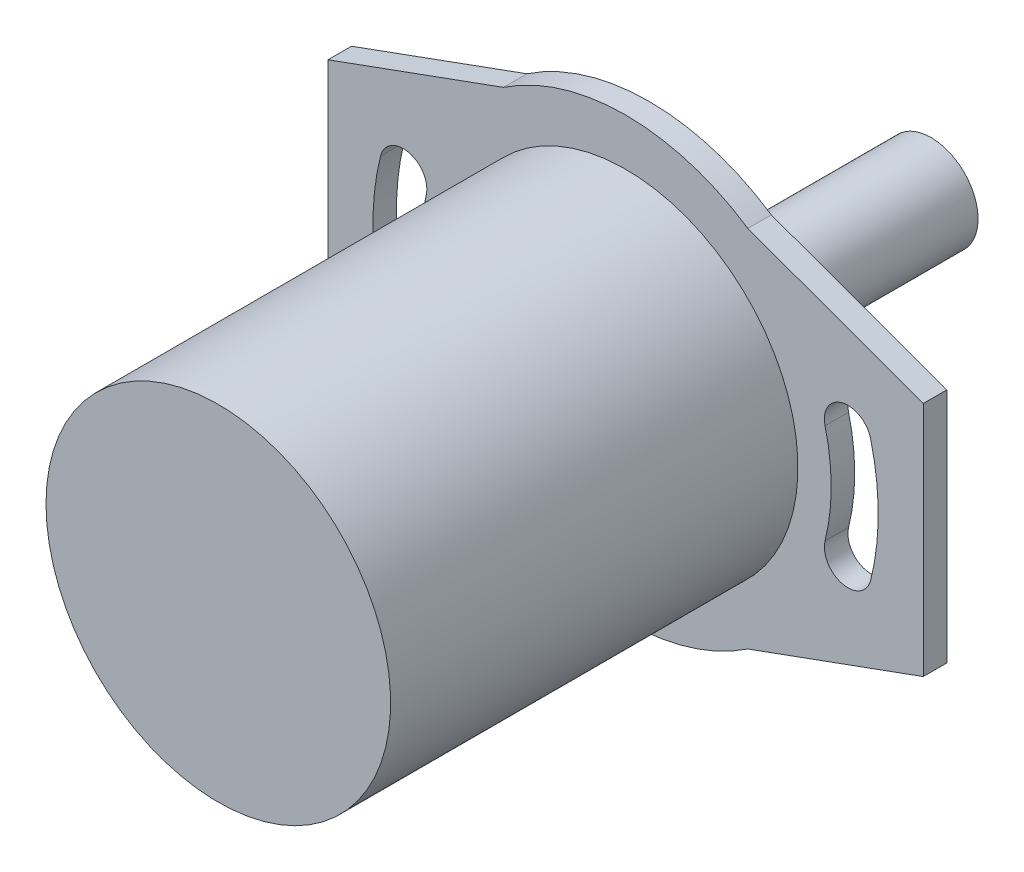
from build123d import *

# Parameters (mm, degrees)
ESQUISSE1_R             = 11
BOSS_EXTRU_1_DEPTH      = 26
BOSS_EXTRU_2_DEPTH      = 1.5
ENL_V_MAT_EXTRU_1_DEPTH = 1.5
ESQUISSE4_R             = 3
BOSS_EXTRU_3_DEPTH      = 18


with BuildPart() as part:
    # Esquisse1 → Boss.-Extru.1 (new body)
    with BuildSketch(Plane.XY):
        with Locations(Location((0, 0, 0), (0, 0, 180))):
            Circle(ESQUISSE1_R)
    extrude(amount=BOSS_EXTRU_1_DEPTH)

    # Esquisse2 → Boss.-Extru.2 (add)
    with BuildSketch(Plane(origin=(0, 0, 0), x_dir=(-1, 0, 0), z_dir=(0, 0, -1))):
        with BuildLine():
            Line((-7.8, 11.625833303), (-19, 7.54936668))
            Line((-19, 7.54936668), (-19, 0))
            Line((-19, 0), (19, 0))
            Line((19, 0), (19, 7.54936668))
            Line((19, 7.54936668), (7.8, 11.625833303))
            ThreePointArc((7.8, 11.625833303), (0, 14), (-7.8, 11.625833303))
        make_face()
    boss_extru_2 = extrude(amount=BOSS_EXTRU_2_DEPTH)

    # Symétrie1: Boss.-Extru.2 across plane
    add(boss_extru_2.mirror(Plane(origin=(19, 0, -1.5), x_dir=(0, 0, 1), z_dir=(0, 1, 0))))

    # Esquisse3 → Enlèv. mat.-Extru.1 (cut)
    with BuildSketch(Plane(origin=(0, 0, -1.5), x_dir=(-1, 0, 0), z_dir=(0, 0, -1))):
        with BuildLine():
            ThreePointArc((-15.644312892, 3.907824988), (-16.124554191, 0), (-15.644312892, -3.907824988))
            ThreePointArc((-15.644312892, -3.907824988), (-13.825754742, -5), (-12.73357973, -3.181441851))
            ThreePointArc((-12.73357973, -3.181441851), (-13.124554191, 0), (-12.73357973, 3.181441851))
            ThreePointArc((-12.73357973, 3.181441851), (-13.825754742, 5), (-15.644312892, 3.907824988))
        make_face()
        with BuildLine():
            ThreePointArc((15.644132561, 3.908546838), (16.125446605, 0), (15.644132561, -3.908546838))
            ThreePointArc((15.644132561, -3.908546838), (13.825032892, -4.99981967), (12.733760061, -3.18072))
            ThreePointArc((12.733760061, -3.18072), (13.125446605, 0), (12.733760061, 3.18072))
            ThreePointArc((12.733760061, 3.18072), (13.825032892, 4.99981967), (15.644132561, 3.908546838))
        make_face()
    extrude(amount=-ENL_V_MAT_EXTRU_1_DEPTH, mode=Mode.SUBTRACT)

    # Esquisse4 → Boss.-Extru.3 (add)
    with BuildSketch(Plane(origin=(0, 0, -1.5), x_dir=(-1, 0, 0), z_dir=(0, 0, -1))):
        Circle(ESQUISSE4_R)
    extrude(amount=BOSS_EXTRU_3_DEPTH)


solid = part.part
